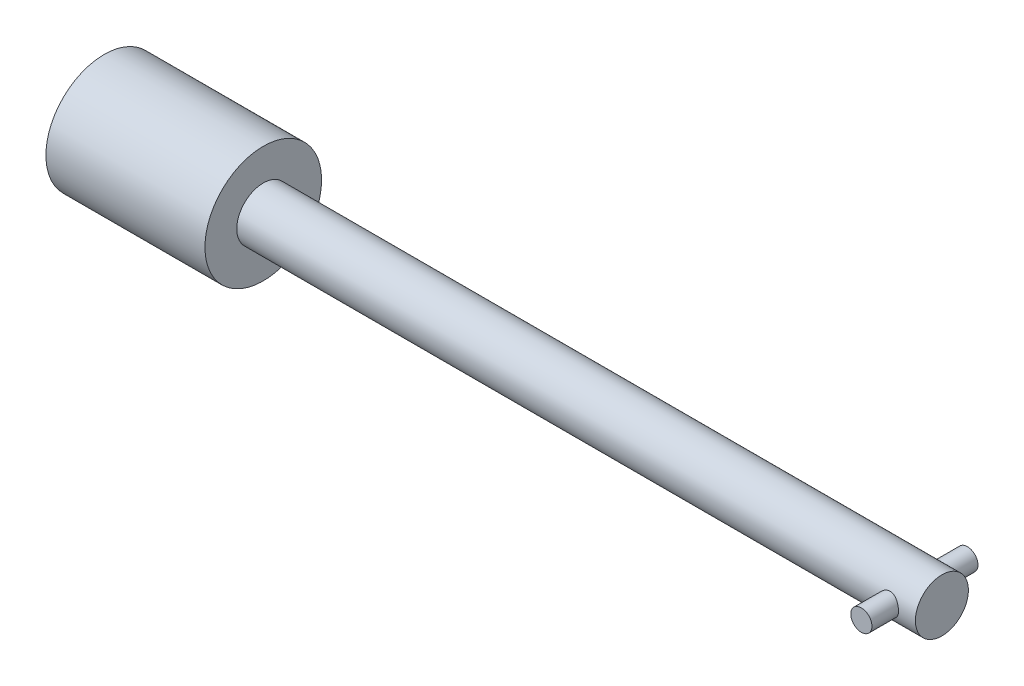
from build123d import *

# Parameters (mm, degrees)
SKETCH1_R                = 5.5
BOSS_EXTRUDE1_DEPTH      = 15
SKETCH2_R                = 2.5
BOSS_EXTRUDE2_DEPTH      = 64
SKETCH3_R                = 2.5
CUT_EXTRUDE1_DEPTH       = 8
BOSS_EXTRUDE3_DEPTH      = 2.5
BOSS_EXTRUDE3_DEPTH_BACK = 7.5
SKETCH4_R                = 1


with BuildPart() as part:
    # Sketch1 → Boss-Extrude1 (new body)
    with BuildSketch(Plane(origin=(0, 0, 0), x_dir=(0, 0, -1), z_dir=(1, 0, 0))):
        Circle(SKETCH1_R)
    extrude(amount=BOSS_EXTRUDE1_DEPTH)

    # Sketch2 → Boss-Extrude2 (add)
    with BuildSketch(Plane(origin=(15, 0, 0), x_dir=(0, 0, -1), z_dir=(1, 0, 0))):
        Circle(SKETCH2_R)
    extrude(amount=BOSS_EXTRUDE2_DEPTH)

    # Sketch3 → Cut-Extrude1 (cut)
    with BuildSketch(Plane.ZY):
        with Locations(Location((0, 0, 0), (0, 0, 180))):
            Circle(SKETCH3_R)
    extrude(amount=-CUT_EXTRUDE1_DEPTH, mode=Mode.SUBTRACT)

    # Sketch4 → Boss-Extrude3 (add, two sides: drawn at the far end of the back side and taken through both)
    with BuildSketch(Plane.XY.offset(2.5).offset(-BOSS_EXTRUDE3_DEPTH_BACK)):
        with Locations((76.405258654, 0)):
            Circle(SKETCH4_R)
    extrude(amount=BOSS_EXTRUDE3_DEPTH + BOSS_EXTRUDE3_DEPTH_BACK)


solid = part.part
